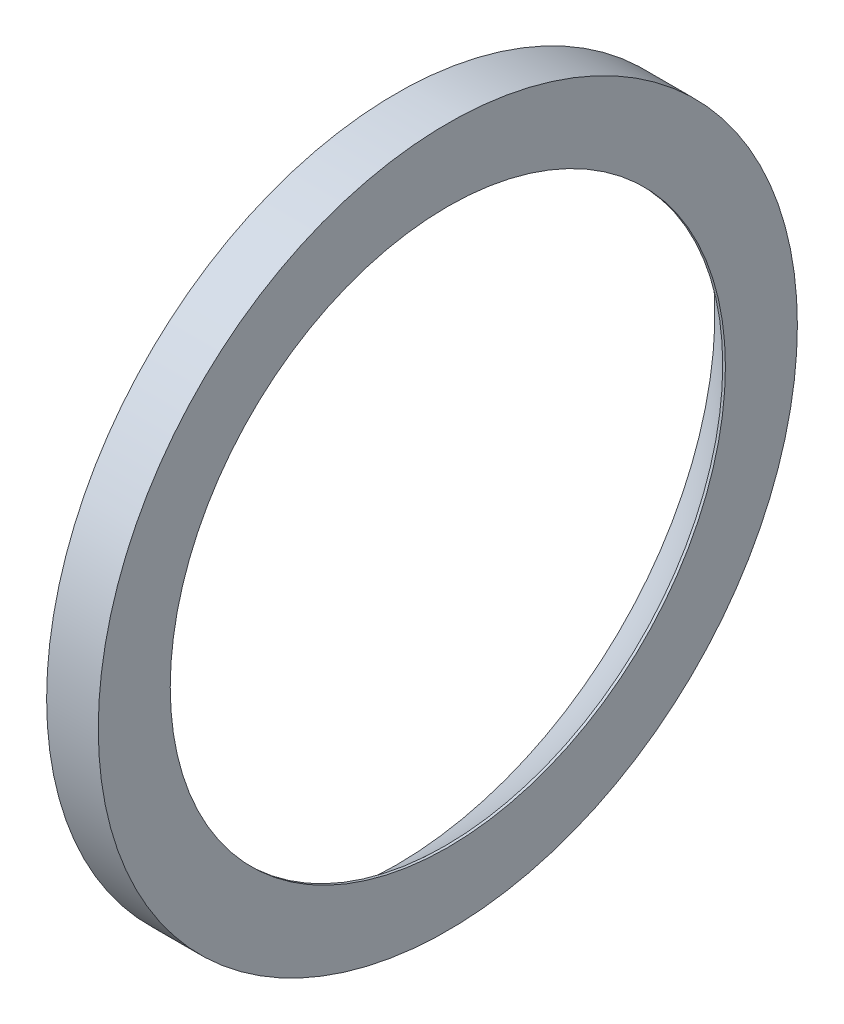
from build123d import *


with BuildPart() as part:
    # Szkic1 → Obrót1 (revolve)
    with BuildSketch(Plane.XY, mode=Mode.PRIVATE) as obr_t1_sk:
        with BuildLine():
            Line((10.988630488, 15.5), (10.988630488, 17))
            Line((10.988630488, 17), (13.369741957, 17))
            Line((13.369741957, 17), (13.5, 17))
            Line((13.5, 17), (13.5, 13.5))
            Line((13.5, 13.5), (13.369741957, 13.5))
            ThreePointArc((13.369741957, 13.5), (12.220170909, 14.548794553), (10.988630488, 15.5))
        make_face()
    revolve(obr_t1_sk.sketch.rotate(Axis((-18.732503666, 0, 0), (1, 0, 0)), 90), axis=Axis((-18.732503666, 0, 0), (1, 0, 0)))


solid = part.part
